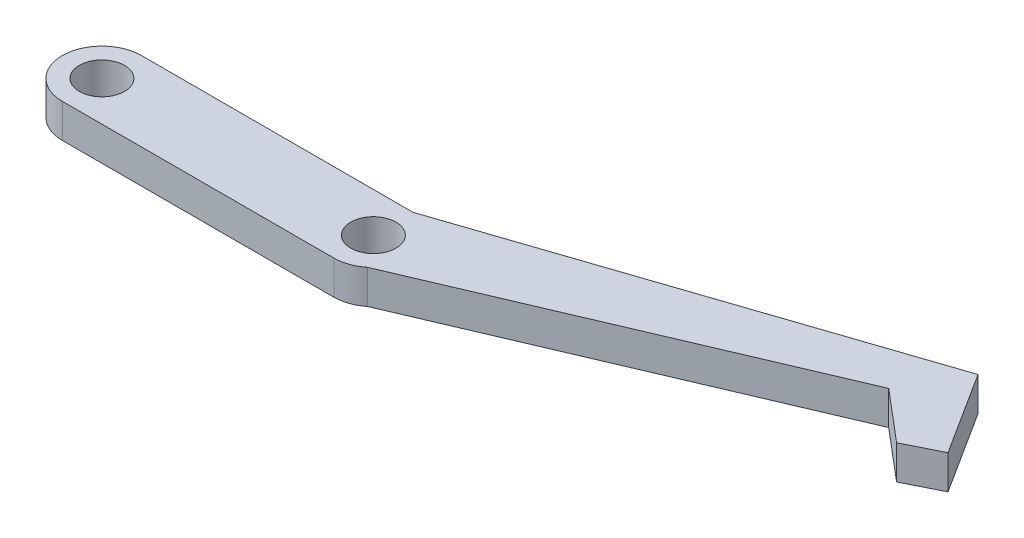
from build123d import *

# Parameters (mm, degrees)
SKETCH_1_R      = 3.5
SKETCH_1_R_2    = 2
EXTRUDE_2_DEPTH = 3


with BuildPart() as part:
    # ｽｹｯﾁ1 → ﾎﾞｽ - 押し出し2 (new body)
    # profile 1 of 4: a face of its own
    with BuildSketch(Plane(origin=(0, 0, 0), x_dir=(1, 0, 0), z_dir=(0, 1, 0))):
        with BuildLine():
            Line((-30.418207164, -18.784024388), (-6.418207164, -18.784024388))
            ThreePointArc((-6.418207164, -18.784024388), (-9.918207164, -15.284024388), (-6.418207164, -11.784024388))
            Line((-6.418207164, -11.784024388), (-30.418207164, -11.784024388))
            ThreePointArc((-30.418207164, -11.784024388), (-27.94333343, -12.809150654), (-26.918207164, -15.284024388))
            ThreePointArc((-26.918207164, -15.284024388), (-27.94333343, -17.758898122), (-30.418207164, -18.784024388))
        make_face()
    # profile 2 of 4: a face of its own
    with BuildSketch(Plane(origin=(0, 0, 0), x_dir=(1, 0, 0), z_dir=(0, 1, 0))):
        with Locations((-30.418207164, -15.284024388)):
            Circle(SKETCH_1_R)
        with Locations(Location((-30.418207164, -15.284024388, 0), (0, 0, 270))):
            Circle(SKETCH_1_R_2, mode=Mode.SUBTRACT)
    # profile 3 of 4: a face of its own
    with BuildSketch(Plane(origin=(0, 0, 0), x_dir=(1, 0, 0), z_dir=(0, 1, 0))):
        with Locations((-6.418207164, -15.284024388)):
            Circle(SKETCH_1_R)
        with Locations(Location((-6.418207164, -15.284024388, 0), (0, 0, 270))):
            Circle(SKETCH_1_R_2, mode=Mode.SUBTRACT)
    # profile 4 of 4: a face of its own
    with BuildSketch(Plane(origin=(0, 0, 0), x_dir=(1, 0, 0), z_dir=(0, 1, 0))):
        with BuildLine():
            ThreePointArc((-2.918207164, -15.284024388), (-3.260445919, -16.793509042), (-4.220232261, -18.007791325))
            Line((-4.220232261, -18.007791325), (28.091680373, -4.237751216))
            Line((28.091680373, -4.237751216), (32.606722729, -8.053690239))
            Line((32.606722729, -8.053690239), (35.636170503, -6.538966352))
            Line((35.636170503, -6.538966352), (30.97548162, 0.772489334))
            Line((30.97548162, 0.772489334), (-6.418207164, -11.784024388))
            ThreePointArc((-6.418207164, -11.784024388), (-3.94333343, -12.809150654), (-2.918207164, -15.284024388))
        make_face()
    extrude(amount=EXTRUDE_2_DEPTH)


solid = part.part
